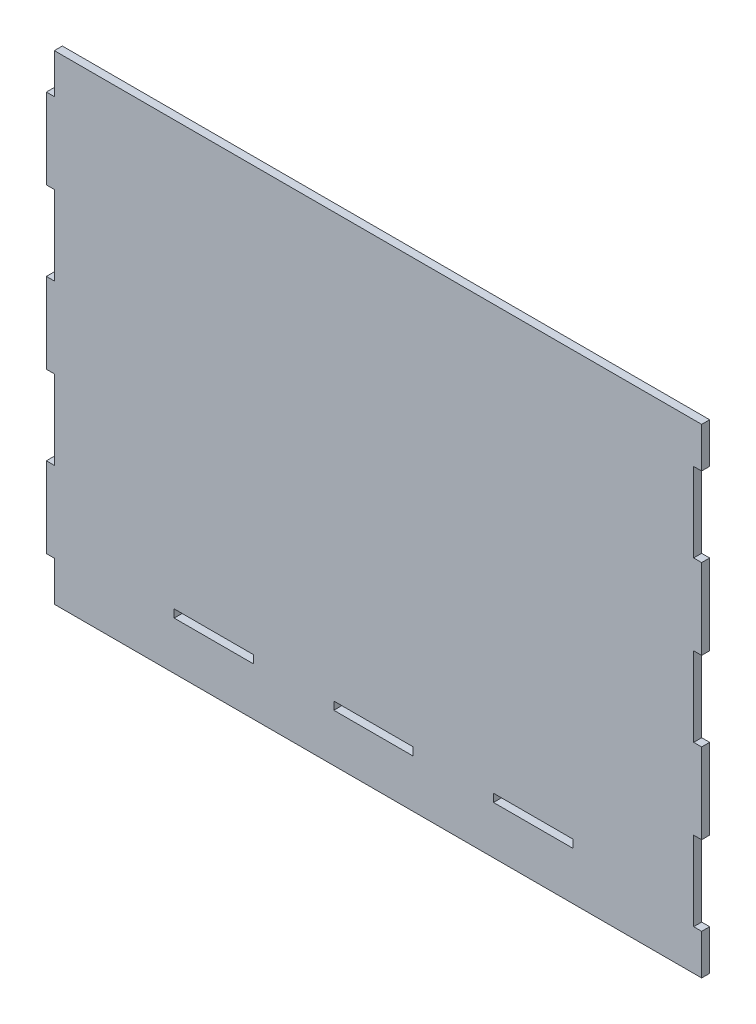
from build123d import *

# Parameters (mm, degrees)
SKIZZE1_W                       = 410
SKIZZE1_H                       = 300
AUFSATZ_LINEAR_AUSTRAGEN1_DEPTH = 5
SKIZZE2_W                       = 46.676040128
SKIZZE2_H                       = 49.6
SCHNITT_LINEAR_AUSTRAGEN1_DEPTH = 5
LINEARES_MUSTER1_COUNT          = 4
LINEARES_MUSTER1_PITCH          = 99.9
SKIZZE3_W                       = 27.663601369
SKIZZE3_H                       = 49.6
SCHNITT_LINEAR_AUSTRAGEN2_DEPTH = 5
LINEARES_MUSTER2_COUNT          = 3
LINEARES_MUSTER2_PITCH          = 99.9
SKIZZE4_W                       = 49.6
SKIZZE4_H                       = 5
SCHNITT_LINEAR_AUSTRAGEN3_DEPTH = 5
LINEARES_MUSTER3_COUNT          = 3
LINEARES_MUSTER3_PITCH          = 99.9


with BuildPart() as part:
    # Skizze1 → Aufsatz-Linear austragen1 (new body)
    with BuildSketch(Plane.XY):
        with Locations((205, 150)):
            Rectangle(SKIZZE1_W, SKIZZE1_H)
    extrude(amount=AUFSATZ_LINEAR_AUSTRAGEN1_DEPTH)

    # Skizze2 → Schnitt-Linear austragen1 (cut)
    with BuildSketch(Plane.XY.offset(5)):
        with Locations((-18.338020064, 299.85)):
            Rectangle(SKIZZE2_W, SKIZZE2_H)
    schnitt_linear_austragen1 = extrude(amount=-SCHNITT_LINEAR_AUSTRAGEN1_DEPTH, mode=Mode.SUBTRACT)

    # Lineares Muster1: Schnitt-Linear austragen1 ×4
    with Locations(*[(0, -i * LINEARES_MUSTER1_PITCH, 0) for i in range(1, LINEARES_MUSTER1_COUNT)]):
        add(schnitt_linear_austragen1, mode=Mode.SUBTRACT)

    # Skizze3 → Schnitt-Linear austragen2 (cut)
    with BuildSketch(Plane.XY.offset(5)):
        with Locations((418.831800685, 249.9)):
            Rectangle(SKIZZE3_W, SKIZZE3_H)
    schnitt_linear_austragen2 = extrude(amount=-SCHNITT_LINEAR_AUSTRAGEN2_DEPTH, mode=Mode.SUBTRACT)

    # Lineares Muster2: Schnitt-Linear austragen2 ×3
    with Locations(*[(0, -i * LINEARES_MUSTER2_PITCH, 0) for i in range(1, LINEARES_MUSTER2_COUNT)]):
        add(schnitt_linear_austragen2, mode=Mode.SUBTRACT)

    # Skizze4 → Schnitt-Linear austragen3 (cut)
    with BuildSketch(Plane.XY.offset(5)):
        with Locations((104.75, 32.5)):
            Rectangle(SKIZZE4_W, SKIZZE4_H)
    schnitt_linear_austragen3 = extrude(amount=-SCHNITT_LINEAR_AUSTRAGEN3_DEPTH, mode=Mode.SUBTRACT)

    # Lineares Muster3: Schnitt-Linear austragen3 ×3
    with Locations(*[(i * LINEARES_MUSTER3_PITCH, 0, 0) for i in range(1, LINEARES_MUSTER3_COUNT)]):
        add(schnitt_linear_austragen3, mode=Mode.SUBTRACT)


solid = part.part
